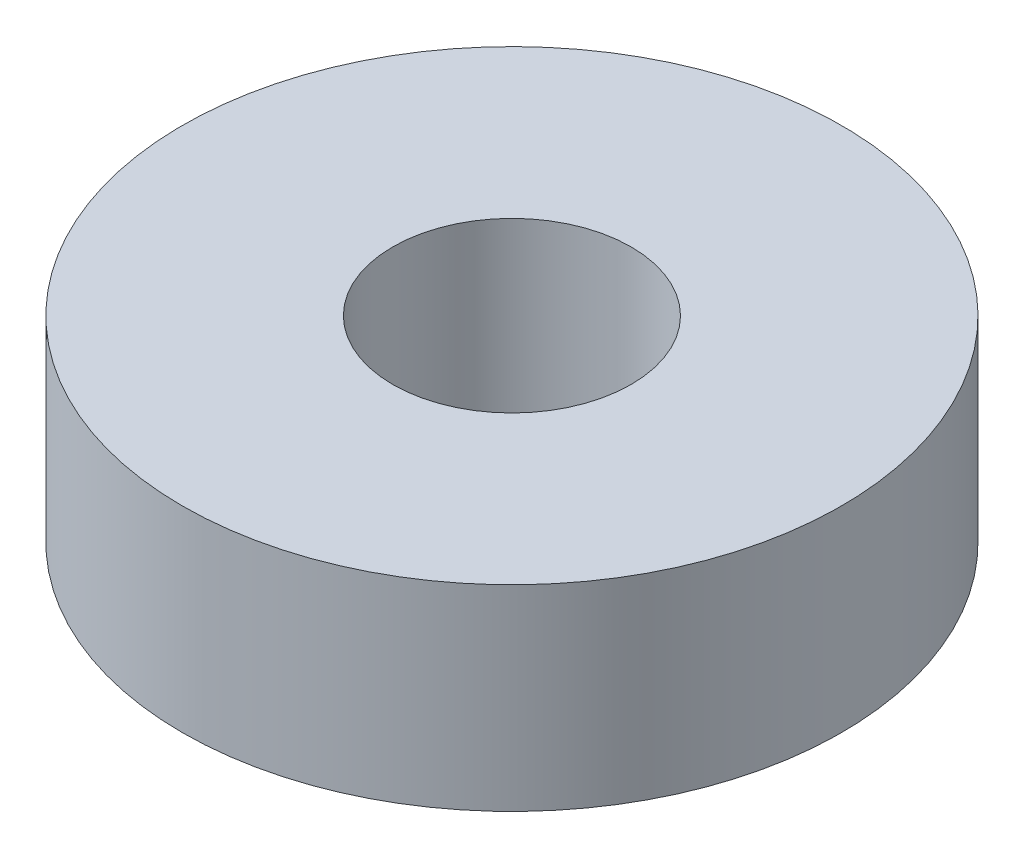
from build123d import *

# Parameters (mm, degrees)
SKETCH_1_R      = 23.5
SKETCH_1_R_2    = 8.5
EXTRUDE_1_DEPTH = 14


with BuildPart() as part:
    # 草图1 → 凸台-拉伸1 (new body)
    with BuildSketch(Plane(origin=(0, 0, 0), x_dir=(1, 0, 0), z_dir=(0, 1, 0))):
        with Locations(Location((0, 0, 0), (0, 0, 270))):
            Circle(SKETCH_1_R)
        with Locations(Location((0, 0, 0), (0, 0, 270))):
            Circle(SKETCH_1_R_2, mode=Mode.SUBTRACT)
    extrude(amount=EXTRUDE_1_DEPTH)


solid = part.part
